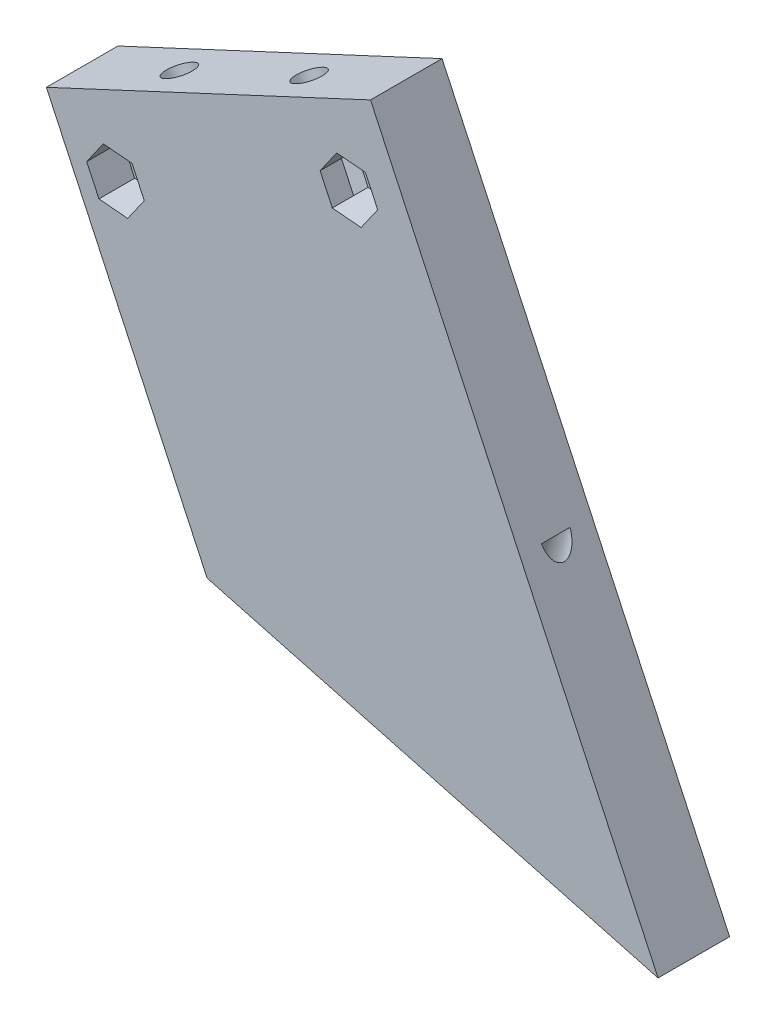
from build123d import *

# Parameters (mm, degrees)
BOSS_EXTRUDE1_DEPTH = 10
SKETCH2_R           = 2
CUT_EXTRUDE1_DEPTH  = 139.371645796
CUT_EXTRUDE2_START  = -4
SKETCH2_3_R         = 2
CUT_EXTRUDE2_DEPTH  = 135.371645796
SKETCH3_R           = 2
CUT_EXTRUDE3_DEPTH  = 35
SKETCH4_R           = 2
CUT_EXTRUDE4_DEPTH  = 10
SKETCH4_3_R         = 2
CUT_EXTRUDE5_DEPTH  = 5


with BuildPart() as part:
    # Sketch1 → Boss-Extrude1 (new body)
    with BuildSketch(Plane.XY):
        Polygon((127.346442995, -36.483176399), (87.147938799, 49.722794044), (41.832549447, 28.591880957), (64.300112266, -19.589962995), align=None)
    extrude(amount=-BOSS_EXTRUDE1_DEPTH)

    # Sketch2 → Cut-Extrude1 (cut, through all)
    with BuildSketch(Plane(origin=(-3.479773272, 7.462397864, 0), x_dir=(0.9063077870366519, 0.4226182617406953, 0), z_dir=(-0.42261826174069533, 0.906307787036652, 0))):
        with Locations(Location((64.996616346, 5, 0), (0, 0, 180))):
            Circle(SKETCH2_R)
        with Locations(Location((84.996616346, 5, 0), (0, 0, 180))):
            Circle(SKETCH2_R)
    extrude(amount=-CUT_EXTRUDE1_DEPTH, mode=Mode.SUBTRACT)

    # Sketch2<3> → Cut-Extrude2 (cut, through all)
    # profile 1 of 2: a face of its own
    with BuildSketch(Plane(origin=(-3.479773272, 7.462397864, 0), x_dir=(0.9063077870366519, 0.4226182617406953, 0), z_dir=(-0.42261826174069533, 0.906307787036652, 0)).offset(CUT_EXTRUDE2_START)):
        Polygon((84.996616346, 0.958548116), (88.496616346, 2.979274058), (88.496616346, 7.020725942), (84.996616346, 9.041451884), (81.496616346, 7.020725942), (81.496616346, 2.979274058), align=None)
        with Locations(Location((84.996616346, 5, 0), (0, 0, 180))):
            Circle(SKETCH2_3_R, mode=Mode.SUBTRACT)
    # profile 2 of 2: a face of its own
    with BuildSketch(Plane(origin=(-3.479773272, 7.462397864, 0), x_dir=(0.9063077870366519, 0.4226182617406953, 0), z_dir=(-0.42261826174069533, 0.906307787036652, 0)).offset(CUT_EXTRUDE2_START)):
        Polygon((68.496616346, 2.979274058), (64.996616346, 0.958548116), (61.496616346, 2.979274058), (61.496616346, 7.020725942), (64.996616346, 9.041451884), (68.496616346, 7.020725942), align=None)
        with Locations(Location((64.996616346, 5, 0), (0, 0, 180))):
            Circle(SKETCH2_3_R, mode=Mode.SUBTRACT)
    extrude(amount=-CUT_EXTRUDE2_DEPTH, mode=Mode.SUBTRACT)

    # Sketch3 → Cut-Extrude3 (cut)
    with BuildSketch(Plane(origin=(-0.59019996, -2.202656237, 0), x_dir=(0.9659258262890685, -0.2588190451025201, 0), z_dir=(-0.2588190451025201, -0.9659258262890685, 0))):
        with Locations((82.809116935, -5)):
            Circle(SKETCH3_R)
        with Locations((102.893564909, -5)):
            Circle(SKETCH3_R)
    extrude(amount=-CUT_EXTRUDE3_DEPTH, mode=Mode.SUBTRACT)

    # Sketch4 → Cut-Extrude4 (cut)
    with BuildSketch(Plane.XY):
        with Locations((84.12365912, 37.27877008)):
            Circle(SKETCH4_R)
        with Locations((51.496578787, 22.064512657)):
            Circle(SKETCH4_R)
    extrude(amount=-CUT_EXTRUDE4_DEPTH, mode=Mode.SUBTRACT)

    # Sketch4<3> → Cut-Extrude5 (cut)
    # profile 1 of 2: a face of its own
    with BuildSketch(Plane.XY):
        Polygon((88.14973206, 36.926534339), (86.44174069, 40.589333653), (82.41566775, 40.941569394), (80.09758618, 37.631005821), (81.805577551, 33.968206507), (85.83165049, 33.615970766), align=None)
        with Locations((84.12365912, 37.27877008)):
            Circle(SKETCH4_3_R, mode=Mode.SUBTRACT)
    # profile 2 of 2: a face of its own
    with BuildSketch(Plane.XY):
        Polygon((55.522651726, 21.712276917), (53.814660356, 25.37507623), (49.788587416, 25.727311971), (47.470505847, 22.416748398), (49.178497217, 18.753949084), (53.204570157, 18.401713344), align=None)
        with Locations((51.496578787, 22.064512657)):
            Circle(SKETCH4_3_R, mode=Mode.SUBTRACT)
    extrude(amount=-CUT_EXTRUDE5_DEPTH, mode=Mode.SUBTRACT)


solid = part.part
